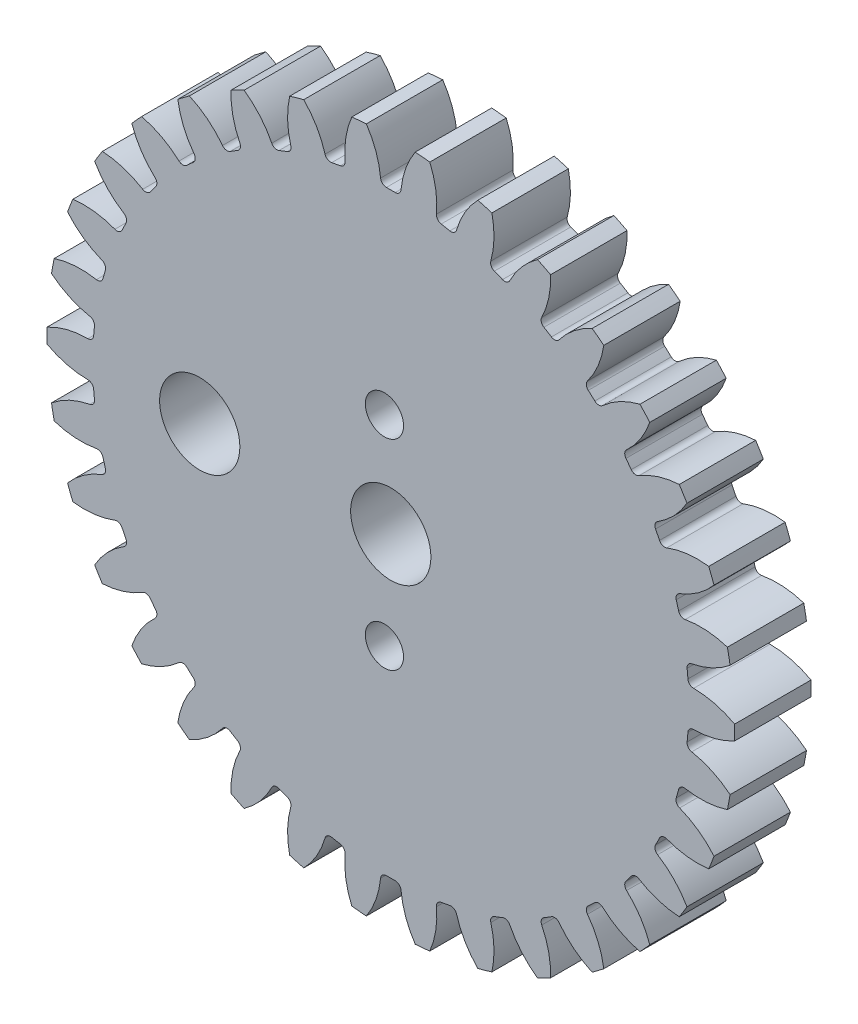
from build123d import *

# Parameters (mm, degrees)
SKETCH1_R                = 9
BOSS_EXTRUDE1_DEPTH      = 1
CUT_EXTRUDE1_DEPTH       = 13.767145335
FILLET1_R                = 0.15
CIRPATTERN1_COUNT        = 34
FILLET1_OF_CIRPATTERN1_R = 0.15
CUT_EXTRUDE2_DEPTH       = 13.868196522
CUT_EXTRUDE2_DEPTH_BACK  = 13.868196522
SKETCH4_R                = 1.05
SKETCH5_R                = 1.05
CUT_EXTRUDE3_DEPTH       = 10
SKETCH6_R                = 0.5
CUT_EXTRUDE4_DEPTH       = 13.868196522


with BuildPart() as part:
    # Sketch1 → Boss-Extrude1 (new, symmetric)
    with BuildSketch(Plane.XY):
        Circle(SKETCH1_R)
    extrude(amount=BOSS_EXTRUDE1_DEPTH, both=True)

    # Sketch3 → Cut-Extrude1 (cut, symmetric)
    with BuildSketch(Plane.XY):
        with BuildLine():
            ThreePointArc((0.258080034, 7.79572926), (0, 7.8), (-0.258080034, 7.79572926))
            ThreePointArc((-0.258080034, 7.79572926), (-0.365908032, 8.413333141), (-0.639939263, 8.977219934))
            ThreePointArc((-0.639939263, 8.977219934), (0, 9), (0.639939263, 8.977219934))
            ThreePointArc((0.639939263, 8.977219934), (0.365908032, 8.413333141), (0.258080034, 7.79572926))
        make_face()
    cut_extrude1 = extrude(amount=CUT_EXTRUDE1_DEPTH, both=True, mode=Mode.SUBTRACT)

    # Fillet1
    fillet1_edges = [part.edges().sort_by_distance(p)[0] for p in [
        (0.258080034, 7.79572926, 0),
        (-0.258080034, 7.79572926, 0),
    ]]
    fillet(fillet1_edges, radius=FILLET1_R)

    # CirPattern1: Cut-Extrude1 ×34 about axis
    cirpattern1_axis = Axis((0, 0, 0), (0, 0, 1))
    for i in range(1, CIRPATTERN1_COUNT):
        add(cut_extrude1.rotate(cirpattern1_axis, i * 360 / CIRPATTERN1_COUNT), mode=Mode.SUBTRACT)

    # Fillet1 of CirPattern1
    fillet1_of_cirpattern1_edges = [part.edges().sort_by_distance(p)[0] for p in [
        (-1.178775761, 7.710414237, 0),
        (-1.686147224, 7.615570073, 0),
        (-2.575489762, 7.362530305, 0),
        (-3.056794692, 7.176071781, 0),
        (-3.884498548, 6.763924233, 0),
        (-4.323346683, 6.492200972, 0),
        (-5.061225395, 5.934980834, 0),
        (-5.442672288, 5.587246045, 0),
        (-6.065598281, 4.903928781, 0),
        (-6.376654216, 4.492024154, 0),
        (-6.863414493, 3.705879315, 0),
        (-7.093486833, 3.243831769, 0),
        (-7.427505356, 2.381630574, 0),
        (-7.568759263, 1.885174584, 0),
        (-7.738661432, 0.97627826, 0),
        (-7.786286675, 0.462320039, 0),
        (-7.786286675, -0.462320039, 0),
        (-7.738661432, -0.97627826, 0),
        (-7.568759263, -1.885174584, 0),
        (-7.427505356, -2.381630574, 0),
        (-7.093486833, -3.243831769, 0),
        (-6.863414493, -3.705879315, 0),
        (-6.376654216, -4.492024154, 0),
        (-6.065598281, -4.903928781, 0),
        (-5.442672288, -5.587246045, 0),
        (-5.061225395, -5.934980834, 0),
        (-4.323346683, -6.492200972, 0),
        (-3.884498548, -6.763924233, 0),
        (-3.056794692, -7.176071781, 0),
        (-2.575489762, -7.362530305, 0),
        (-1.686147224, -7.615570073, 0),
        (-1.178775761, -7.710414237, 0),
        (-0.258080034, -7.79572926, 0),
        (0.258080034, -7.79572926, 0),
        (1.178775761, -7.710414237, 0),
        (1.686147224, -7.615570073, 0),
        (2.575489762, -7.362530305, 0),
        (3.056794692, -7.176071781, 0),
        (3.884498548, -6.763924233, 0),
        (4.323346683, -6.492200972, 0),
        (5.061225395, -5.934980834, 0),
        (5.442672288, -5.587246045, 0),
        (6.065598281, -4.903928781, 0),
        (6.376654216, -4.492024154, 0),
        (6.863414493, -3.705879315, 0),
        (7.093486833, -3.243831769, 0),
        (7.427505356, -2.381630574, 0),
        (7.568759263, -1.885174584, 0),
        (7.738661432, -0.97627826, 0),
        (7.786286675, -0.462320039, 0),
        (7.786286675, 0.462320039, 0),
        (7.738661432, 0.97627826, 0),
        (7.568759263, 1.885174584, 0),
        (7.427505356, 2.381630574, 0),
        (7.093486833, 3.243831769, 0),
        (6.863414493, 3.705879315, 0),
        (6.376654216, 4.492024154, 0),
        (6.065598281, 4.903928781, 0),
        (5.442672288, 5.587246045, 0),
        (5.061225395, 5.934980834, 0),
        (4.323346683, 6.492200972, 0),
        (3.884498548, 6.763924233, 0),
        (3.056794692, 7.176071781, 0),
        (2.575489762, 7.362530305, 0),
        (1.686147224, 7.615570073, 0),
        (1.178775761, 7.710414237, 0),
    ]]
    fillet(fillet1_of_cirpattern1_edges, radius=FILLET1_OF_CIRPATTERN1_R)

    # Sketch4 → Cut-Extrude2 (cut, two sides: drawn at the far end of the back side and taken through both)
    with BuildSketch(Plane.XY.offset(1).offset(-CUT_EXTRUDE2_DEPTH_BACK)):
        Circle(SKETCH4_R)
    extrude(amount=CUT_EXTRUDE2_DEPTH + CUT_EXTRUDE2_DEPTH_BACK, mode=Mode.SUBTRACT)

    # Sketch5 → Cut-Extrude3 (cut)
    with BuildSketch(Plane.XY.offset(1)):
        with Locations((-5, 0)):
            Circle(SKETCH5_R)
    extrude(amount=-CUT_EXTRUDE3_DEPTH, mode=Mode.SUBTRACT)

    # Sketch6 → Cut-Extrude4 (cut, through all)
    with BuildSketch(Plane.XY.offset(1)):
        with Locations((-0.16625649, -2.62)):
            Circle(SKETCH6_R)
        with Locations(Location((-0.16625649, 2.62, 0), (0, 0, 180))):
            Circle(SKETCH6_R)
    extrude(amount=-CUT_EXTRUDE4_DEPTH, mode=Mode.SUBTRACT)


solid = part.part
